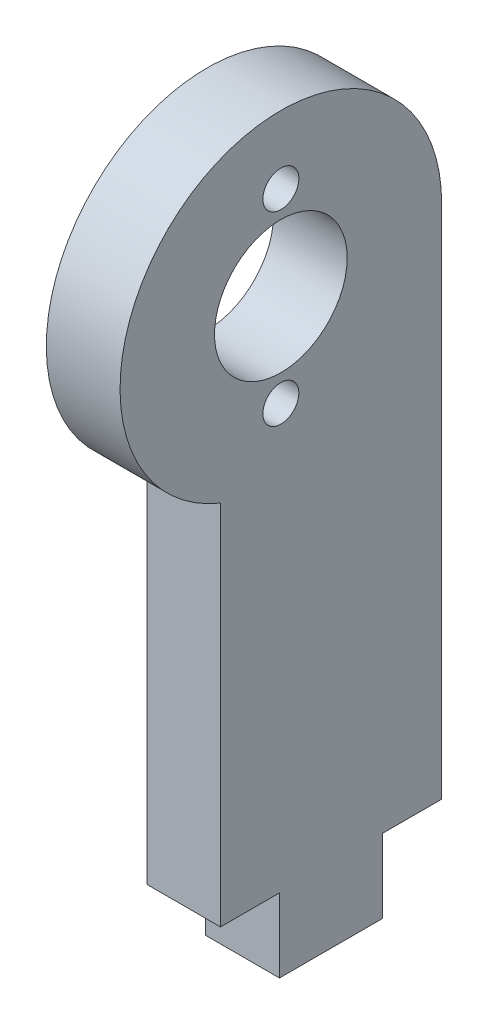
from build123d import *

# Parameters (mm, degrees)
SKETCH1_R              = 5.715
BOSS_EXTRUDE1_DEPTH    = 6.35
M2_5_CLEARANCE_HOLE1_D = 3.1


with BuildPart() as part:
    # Sketch1 → Boss-Extrude1 (new body)
    with BuildSketch(Plane(origin=(0, 0, 0), x_dir=(0, 0, -1), z_dir=(1, 0, 0))):
        with BuildLine():
            Line((5.08, 0), (13.97, 0))
            Line((13.97, 0), (13.97, 6.35))
            Line((13.97, 6.35), (19.05, 6.35))
            Line((19.05, 6.35), (19.05, 50.8))
            ThreePointArc((19.05, 50.8), (-2.539589782, 62.285697628), (0, 37.963236389))
            Line((0, 37.963236389), (0, 6.35))
            Line((0, 6.35), (5.08, 6.35))
            Line((5.08, 6.35), (5.08, 0))
        make_face()
        with Locations((5.2, 50.8)):
            Circle(SKETCH1_R, mode=Mode.SUBTRACT)
    extrude(amount=BOSS_EXTRUDE1_DEPTH)

    # M2.5 Clearance Hole1 (through all)
    with Locations(Plane(origin=(6.35, 0, 0), x_dir=(0, 0, -1), z_dir=(1, 0, 0))):
        with Locations((5.2, 58.8), (5.2, 42.8)):
            Hole(M2_5_CLEARANCE_HOLE1_D / 2)


solid = part.part
